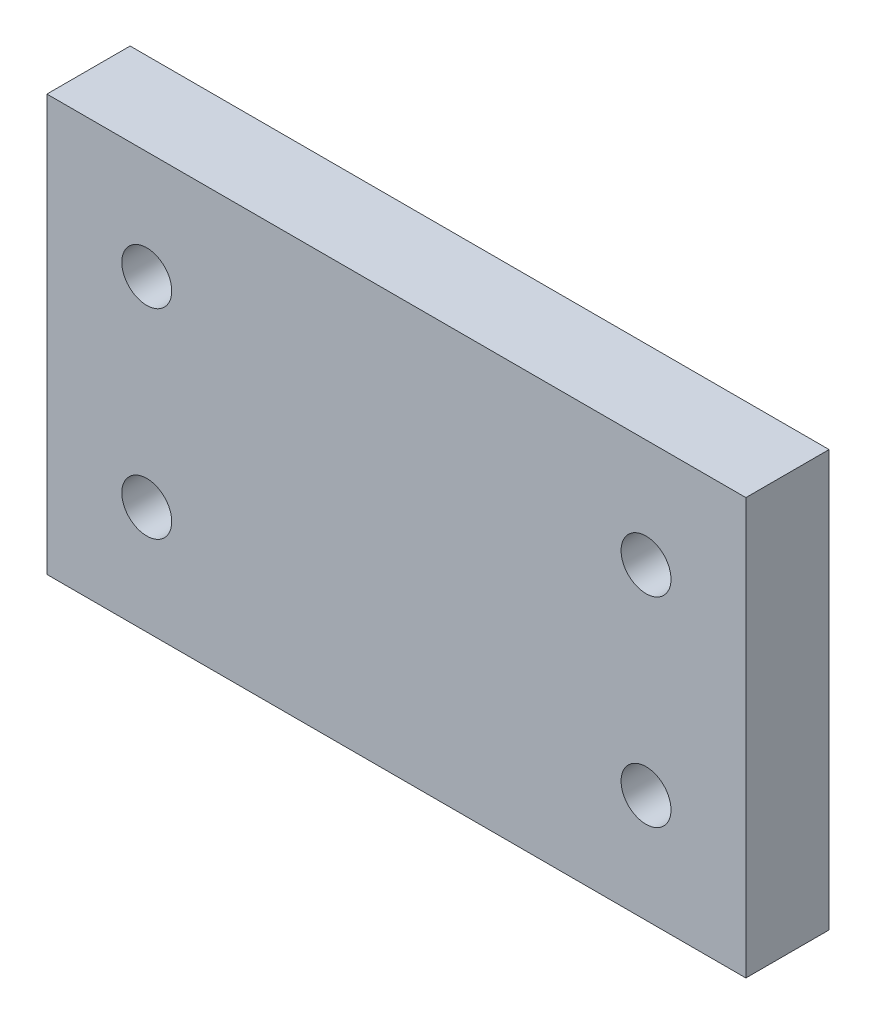
from build123d import *

# Parameters (mm, degrees)
SKETCH_1_W      = 42
SKETCH_1_H      = 25
SKETCH_1_R      = 1.5
EXTRUDE_1_DEPTH = 5


with BuildPart() as part:
    # 草图1 → 凸台-拉伸1 (new body)
    with BuildSketch(Plane.XY):
        Rectangle(SKETCH_1_W, SKETCH_1_H)
        with Locations((15, 6)):
            Circle(SKETCH_1_R, mode=Mode.SUBTRACT)
        with Locations((15, -6)):
            Circle(SKETCH_1_R, mode=Mode.SUBTRACT)
        with Locations((-15, -6)):
            Circle(SKETCH_1_R, mode=Mode.SUBTRACT)
        with Locations((-15, 6)):
            Circle(SKETCH_1_R, mode=Mode.SUBTRACT)
    extrude(amount=EXTRUDE_1_DEPTH)


solid = part.part
